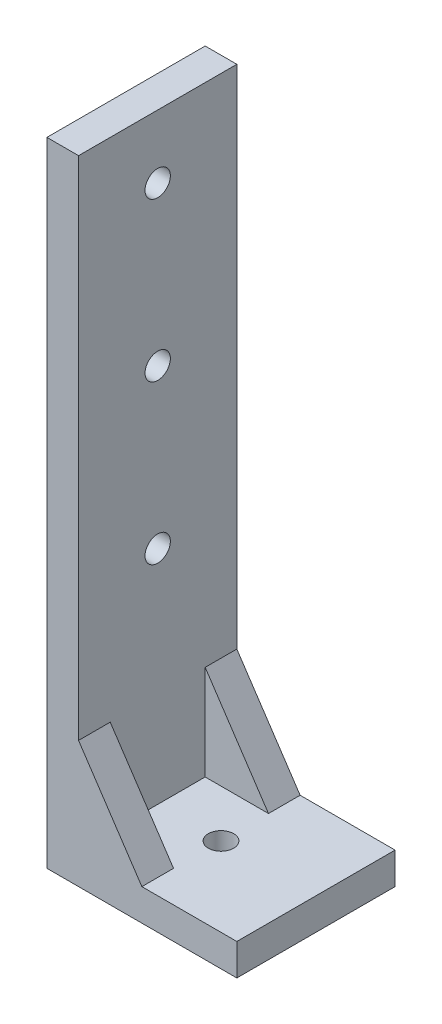
from build123d import *

# Parameters (mm, degrees)
BOSS_EXTRUDE1_DEPTH = 25
SKETCH2_R           = 4
CUT_EXTRUDE1_DEPTH  = 201.81085628
SKETCH3_R           = 4
CUT_EXTRUDE2_DEPTH  = 208.665596573
BOSS_EXTRUDE2_DEPTH = 10


with BuildPart() as part:
    # Sketch1 → Boss-Extrude1 (new, symmetric)
    with BuildSketch(Plane.XY):
        Polygon((0, 0), (0, 200), (10, 200), (10, 10), (60, 10), (60, 0), align=None)
    extrude(amount=BOSS_EXTRUDE1_DEPTH, both=True)

    # Sketch2 → Cut-Extrude1 (cut, through all)
    with BuildSketch(Plane(origin=(0, 10, 0), x_dir=(1, 0, 0), z_dir=(0, 1, 0))):
        with Locations(Location((30, 0, 0), (0, 0, 180))):
            Circle(SKETCH2_R)
    extrude(amount=-CUT_EXTRUDE1_DEPTH, mode=Mode.SUBTRACT)

    # Sketch3 → Cut-Extrude2 (cut, through all)
    with BuildSketch(Plane(origin=(10, 0, 0), x_dir=(0, 0, -1), z_dir=(1, 0, 0))):
        with Locations((0, 180)):
            Circle(SKETCH3_R)
        with Locations((0, 130)):
            Circle(SKETCH3_R)
        with Locations((0, 80)):
            Circle(SKETCH3_R)
    extrude(amount=-CUT_EXTRUDE2_DEPTH, mode=Mode.SUBTRACT)

    # Sketch5 → Boss-Extrude2 (add)
    with BuildSketch(Plane.XY.offset(25)):
        Polygon((10, 10), (30, 10), (10, 40), align=None)
    boss_extrude2 = extrude(amount=-BOSS_EXTRUDE2_DEPTH)

    # Mirror1: Boss-Extrude2 across plane
    add(boss_extrude2.mirror(Plane(origin=(0, 0, 0), x_dir=(1, 0, 0), z_dir=(0, 0, -1))))


solid = part.part
